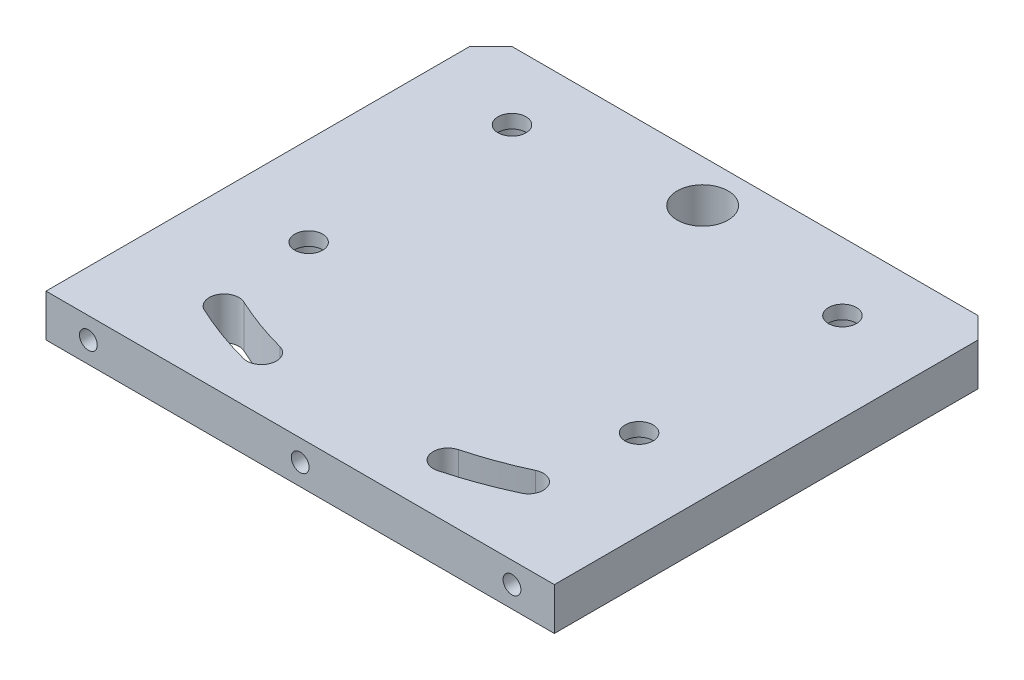
from build123d import *

# Parameters (mm, degrees)
SKETCH_1_W                = 120
SKETCH_1_H                = 105
EXTRUDE_1_DEPTH           = 10
HOLE_WIZARD_1_D           = 6.6
HOLE_WIZARD_1_CBORE_D     = 11
HOLE_WIZARD_1_CBORE_DEPTH = 6.8
HOLE_WIZARD_1_2_D         = 12
CUT_EXTRUDE_2_REACH       = 82.351
HOLE_WIZARD_M5_1_D        = 4.2
HOLE_WIZARD_M5_1_DEPTH    = 10.4
HOLE_WIZARD_M5_1_TIP      = 1.2618073
CHAMFER_1_SIZE            = 5


with BuildPart() as part:
    # 草图1 → 凸台-拉伸1 (new body)
    with BuildSketch(Plane(origin=(0, 0, 0), x_dir=(1, 0, 0), z_dir=(0, 1, 0))):
        Rectangle(SKETCH_1_W, SKETCH_1_H)
    extrude(amount=EXTRUDE_1_DEPTH)

    # Hole Wizard 1 (through all)
    with Locations(Plane(origin=(0, 0, 0), x_dir=(-1, 0, 0), z_dir=(0, -1, 0))):
        with Locations((39, -11.5), (-39, -11.5), (-39, 36.5), (39, 36.5)):
            CounterBoreHole(HOLE_WIZARD_1_D / 2, HOLE_WIZARD_1_CBORE_D / 2, HOLE_WIZARD_1_CBORE_DEPTH)

    # Hole Wizard 1 2 (through all)
    with Locations(Plane(origin=(0, 10, 0), x_dir=(1, 0, 0), z_dir=(0, 1, 0))):
        with Locations((0, 42.5)):
            Hole(HOLE_WIZARD_1_2_D / 2)

    # 草图7 → 切除-拉伸2 (cut, up to next)
    with BuildSketch(Plane(origin=(0, 10, 0), x_dir=(1, 0, 0), z_dir=(0, 1, 0)), mode=Mode.PRIVATE) as cut_extrude_2_sk1:
        with BuildLine():
            ThreePointArc((-37.401716164, -37.708239153), (-30.268782684, -40.66279694), (-22.905485492, -42.984435627))
            ThreePointArc((-22.905485492, -42.984435627), (-18.618878442, -40.509561892), (-21.093752176, -36.222954843))
            ThreePointArc((-21.093752176, -36.222954843), (-27.874641681, -34.084948594), (-34.443388332, -31.364084643))
            ThreePointArc((-34.443388332, -31.364084643), (-39.094629503, -33.056997982), (-37.401716164, -37.708239153))
        make_face()
    cut_extrude_2_tool1 = extrude(cut_extrude_2_sk1.sketch, amount=-CUT_EXTRUDE_2_REACH, mode=Mode.PRIVATE) & part.part
    # 草图7 → 切除-拉伸2 (cut, up to next)
    with BuildSketch(Plane(origin=(0, 10, 0), x_dir=(1, 0, 0), z_dir=(0, 1, 0)), mode=Mode.PRIVATE) as cut_extrude_2_sk2:
        with BuildLine():
            ThreePointArc((34.443388332, -31.364084643), (39.094629503, -33.056997982), (37.401716164, -37.708239153))
            ThreePointArc((37.401716164, -37.708239153), (30.268782684, -40.66279694), (22.905485492, -42.984435627))
            ThreePointArc((22.905485492, -42.984435627), (18.618878442, -40.509561892), (21.093752176, -36.222954843))
            ThreePointArc((21.093752176, -36.222954843), (27.874641681, -34.084948594), (34.443388332, -31.364084643))
        make_face()
    cut_extrude_2_tool2 = extrude(cut_extrude_2_sk2.sketch, amount=-CUT_EXTRUDE_2_REACH, mode=Mode.PRIVATE) & part.part
    add(cut_extrude_2_tool1.solids().sort_by_distance((-29.014889, 10, 37.217751))[0], mode=Mode.SUBTRACT)
    add(cut_extrude_2_tool2.solids().sort_by_distance((29.014889, 10, 37.217751))[0], mode=Mode.SUBTRACT)

    # M5 螺纹孔1
    with Locations(Plane(origin=(-19.270259274, 3.138381988, 52.5), x_dir=(1, 0, 0), z_dir=(0, 0, 1))):
        with Locations((-30.729740726, 1.861618012), (69.270259274, 1.861618012), (19.270259274, 1.861618012)):
            Hole(HOLE_WIZARD_M5_1_D / 2, depth=HOLE_WIZARD_M5_1_DEPTH)
            with Locations((0, 0, -(HOLE_WIZARD_M5_1_DEPTH + HOLE_WIZARD_M5_1_TIP / 2))):  # 118° drill point
                Cone(0, HOLE_WIZARD_M5_1_D / 2, HOLE_WIZARD_M5_1_TIP, mode=Mode.SUBTRACT)

    # 倒角1
    chamfer_1_edges = [part.edges().sort_by_distance(p)[0] for p in [
        (-60, 5, -52.5),
        (60, 5, -52.5),
    ]]
    chamfer(chamfer_1_edges, length=CHAMFER_1_SIZE)


solid = part.part
